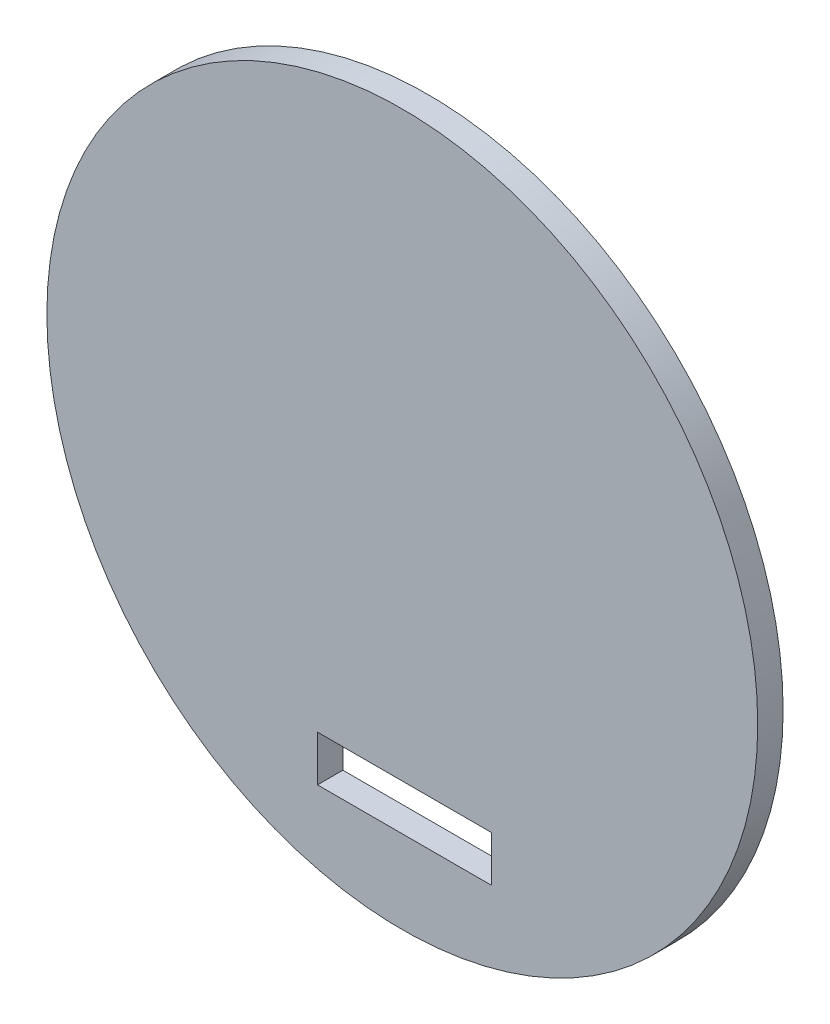
from build123d import *

# Parameters (mm, degrees)
SKETCH1_R           = 14
SKETCH1_W           = 6.85
SKETCH1_H           = 1.8
BOSS_EXTRUDE4_DEPTH = 1


with BuildPart() as part:
    # Sketch1 → Boss-Extrude4 (new body)
    with BuildSketch(Plane.XY):
        Circle(SKETCH1_R)
        with Locations((0.084285819, -9.827892173)):
            Rectangle(SKETCH1_W, SKETCH1_H, mode=Mode.SUBTRACT)
    extrude(amount=BOSS_EXTRUDE4_DEPTH)


solid = part.part
